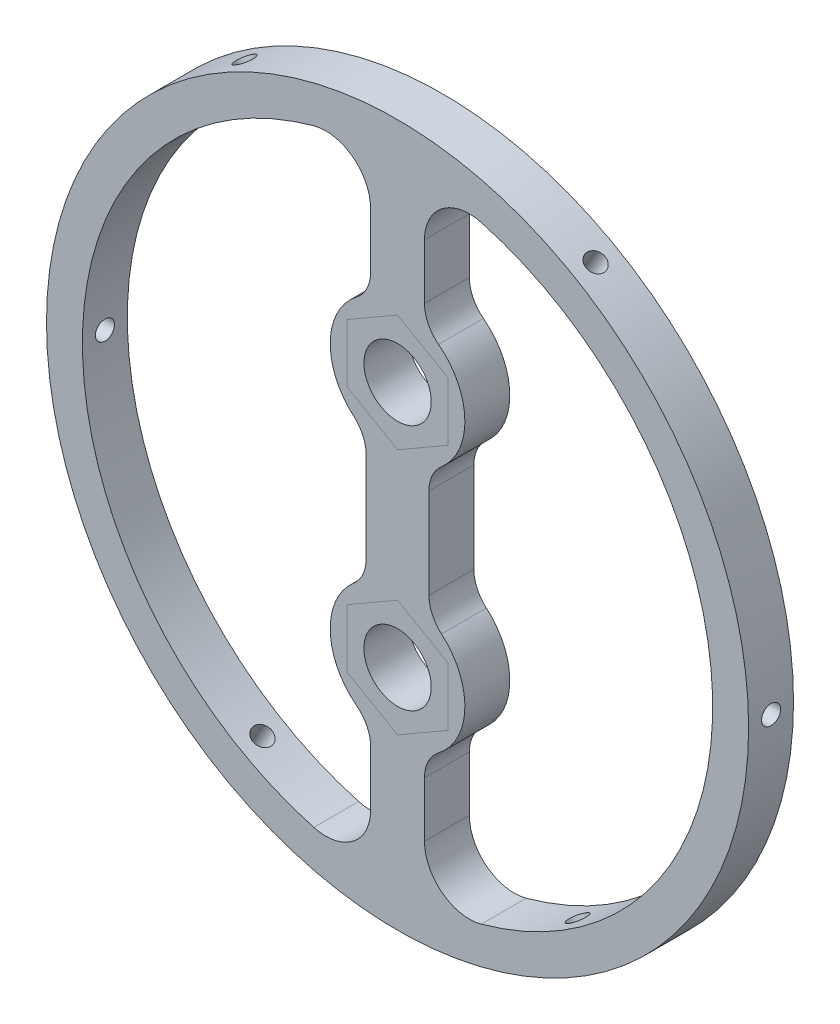
from build123d import *

# Parameters (mm, degrees)
SKETCH1_R                 = 49.657
BOSS_EXTRUDE1_DEPTH       = 6.35
CUT_EXTRUDE1_DEPTH        = 71.512111002
FILLET1_R                 = 6.35
FILLET2_R                 = 5.08
SKETCH4_R                 = 4.7625
CUT_EXTRUDE2_DEPTH        = 71.512111002
F_6_32_TAPPED_HOLE1_D     = 2.7051
F_6_32_TAPPED_HOLE1_DEPTH = 12.7
CIRPATTERN1_COUNT         = 6


with BuildPart() as part:
    # Sketch1 → Boss-Extrude1 (new body)
    with BuildSketch(Plane.XY):
        Circle(SKETCH1_R)
    extrude(amount=BOSS_EXTRUDE1_DEPTH)

    # Sketch3 → Cut-Extrude1 (cut, through all)
    with BuildSketch(Plane.XY.offset(6.35)):
        with BuildLine():
            Line((-3.81, 44.41388104), (-3.81, 26.192306699))
            ThreePointArc((-3.81, 26.192306699), (-9.518480656, 17.814850668), (-4.445, 9.038273032))
            Line((-4.445, 9.038273032), (-4.445, -9.038273032))
            ThreePointArc((-4.445, -9.038273032), (-9.518480656, -17.814850668), (-3.81, -26.192306699))
            Line((-3.81, -26.192306699), (-3.81, -44.41388104))
            ThreePointArc((-3.81, -44.41388104), (-44.577, 0), (-3.81, 44.41388104))
        make_face()
        with BuildLine():
            Line((3.81, 44.41388104), (3.81, 26.192306699))
            ThreePointArc((3.81, 26.192306699), (9.518480656, 17.814850668), (4.445, 9.038273032))
            Line((4.445, 9.038273032), (4.445, -9.038273032))
            ThreePointArc((4.445, -9.038273032), (9.518480656, -17.814850668), (3.81, -26.192306699))
            Line((3.81, -26.192306699), (3.81, -44.41388104))
            ThreePointArc((3.81, -44.41388104), (44.577, 0), (3.81, 44.41388104))
        make_face()
    extrude(amount=-CUT_EXTRUDE1_DEPTH, mode=Mode.SUBTRACT)

    # Fillet1
    fillet1_edges = [part.edges().sort_by_distance(p)[0] for p in [
        (-3.81, 44.41388104, 3.175),
        (-3.81, -44.41388104, 3.175),
        (3.81, 44.41388104, 3.175),
        (3.81, -44.41388104, 3.175),
    ]]
    fillet(fillet1_edges, radius=FILLET1_R)

    # Fillet2
    fillet2_edges = [part.edges().sort_by_distance(p)[0] for p in [
        (-3.81, 26.192306699, 3.175),
        (-4.445, 9.038273032, 3.175),
        (-4.445, -9.038273032, 3.175),
        (-3.81, -26.192306699, 3.175),
        (4.445, 9.038273032, 3.175),
        (3.81, 26.192306699, 3.175),
        (3.81, -26.192306699, 3.175),
        (4.445, -9.038273032, 3.175),
    ]]
    fillet(fillet2_edges, radius=FILLET2_R)

    # Sketch4 → Cut-Extrude2 (cut, through all)
    with BuildSketch(Plane.XY.offset(6.35)):
        with Locations((0, 17.4625)):
            Circle(SKETCH4_R)
        with Locations((0, -17.4625)):
            Circle(SKETCH4_R)
    extrude(amount=-CUT_EXTRUDE2_DEPTH, mode=Mode.SUBTRACT)

    # #6-32 Tapped Hole1
    with Locations(Plane(origin=(49.65699993, -0.002635703, 3.166396975), x_dir=(5.3078169e-05, 0.999999998591, 0), z_dir=(0.999999998591, -5.3078169e-05, 0))):
        with Locations((0, 0)):
            f_6_32_tapped_hole1 = Hole(F_6_32_TAPPED_HOLE1_D / 2, depth=F_6_32_TAPPED_HOLE1_DEPTH)

    # CirPattern1: #6-32 Tapped Hole1 ×6 about axis
    cirpattern1_axis = Axis((0, 0, 6.35), (0, 0, -1))
    for i in range(1, CIRPATTERN1_COUNT):
        add(f_6_32_tapped_hole1.rotate(cirpattern1_axis, i * 360 / CIRPATTERN1_COUNT), mode=Mode.SUBTRACT)


solid = part.part
